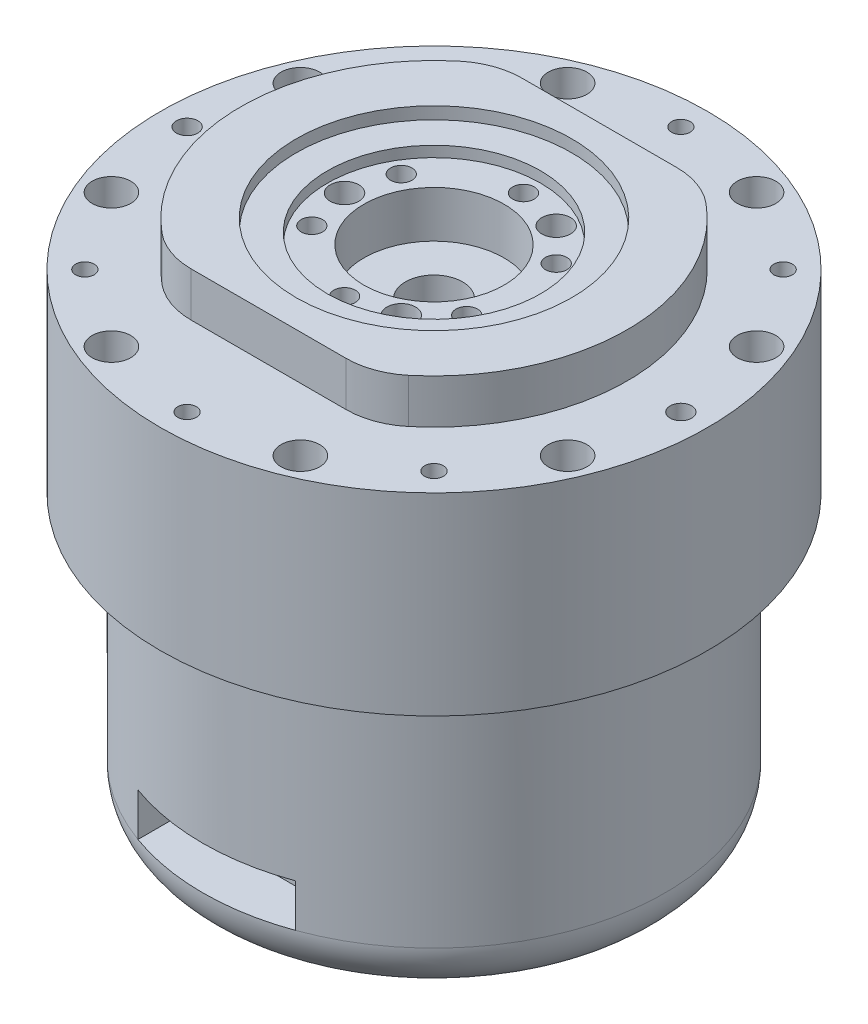
from build123d import *

# Parameters (mm, degrees)
SKETCH_2_R           = 38.25
SKETCH_2_R_2         = 1.3
EXTRUDE_1_DEPTH      = 27
EXTRUDE_2_DEPTH      = 6.2
SKETCH_4_R           = 19.25
CUT_EXTRUDE_1_DEPTH  = 1.7
SKETCH_5_R           = 14.9
CUT_EXTRUDE_2_DEPTH  = 3.2
SKETCH_6_R           = 1.5
CUT_EXTRUDE_3_DEPTH  = 8
SKETCH_7_R           = 2
CUT_EXTRUDE_4_DEPTH  = 4.5
SKETCH_8_R           = 32.3
EXTRUDE_3_DEPTH      = 39.3
FILLET_1_R           = 7
FILLET_2_R           = 10
SKETCH_9_W           = 22
SKETCH_9_H           = 6
CUT_EXTRUDE_5_DEPTH  = 15
SKETCH_10_W          = 22
SKETCH_10_H          = 13
CUT_EXTRUDE_6_DEPTH  = 15
SKETCH_12_R          = 9.8
CUT_EXTRUDE_7_DEPTH  = 6.5
SKETCH_13_R          = 4
CUT_EXTRUDE_8_DEPTH  = 6
SKETCH_14_R          = 2.7
CUT_EXTRUDE_9_DEPTH  = 7
SKETCH_15_R          = 1.2
CUT_EXTRUDE_10_DEPTH = 4
SKETCH_16_R          = 1.3
SKETCH_16_R_2        = 1.2
EXTRUDE_4_DEPTH      = 12
SKETCH_18_R          = 1.3
EXTRUDE_5_DEPTH      = 9
SKETCH_19_R          = 1.5
CUT_EXTRUDE_11_DEPTH = 10


with BuildPart() as part:
    # 草图2 → 凸台-拉伸1 (new body)
    with BuildSketch(Plane(origin=(0, 0, 0), x_dir=(1, 0, 0), z_dir=(0, 1, 0))):
        with Locations(Location((0, 0, 0), (0, 0, 270))):
            Circle(SKETCH_2_R)
        with Locations(Location((0, 34.5, 0), (0, 0, 270))):
            Circle(SKETCH_2_R_2, mode=Mode.SUBTRACT)
        with Locations(Location((-24.395183951, 24.395183951, 0), (0, 0, 270))):
            Circle(SKETCH_2_R_2, mode=Mode.SUBTRACT)
        with Locations(Location((-34.5, 0, 0), (0, 0, 270))):
            Circle(SKETCH_2_R_2, mode=Mode.SUBTRACT)
        with Locations(Location((-24.395183951, -24.395183951, 0), (0, 0, 270))):
            Circle(SKETCH_2_R_2, mode=Mode.SUBTRACT)
        with Locations(Location((0, -34.5, 0), (0, 0, 270))):
            Circle(SKETCH_2_R_2, mode=Mode.SUBTRACT)
        with Locations(Location((24.395183951, -24.395183951, 0), (0, 0, 270))):
            Circle(SKETCH_2_R_2, mode=Mode.SUBTRACT)
        with Locations(Location((34.5, 0, 0), (0, 0, 270))):
            Circle(SKETCH_2_R_2, mode=Mode.SUBTRACT)
        with Locations(Location((24.395183951, 24.395183951, 0), (0, 0, 270))):
            Circle(SKETCH_2_R_2, mode=Mode.SUBTRACT)
    extrude(amount=EXTRUDE_1_DEPTH)

    # 草图3 → 凸台-拉伸2 (add)
    with BuildSketch(Plane(origin=(0, 27, 0), x_dir=(1, 0, 0), z_dir=(0, 1, 0))):
        with BuildLine():
            Line((-13.978197309, 23.1), (13.978197309, 23.1))
            ThreePointArc((13.978197309, 23.1), (27, 0), (13.978197309, -23.1))
            Line((13.978197309, -23.1), (-13.978197309, -23.1))
            ThreePointArc((-13.978197309, -23.1), (-27, 0), (-13.978197309, 23.1))
        make_face()
    extrude(amount=EXTRUDE_2_DEPTH)

    # 草图4 → 切除-拉伸1 (cut)
    with BuildSketch(Plane(origin=(0, 33.2, 0), x_dir=(1, 0, 0), z_dir=(0, 1, 0))):
        with Locations(Location((0, 0, 0), (0, 0, 270))):
            Circle(SKETCH_4_R)
    extrude(amount=-CUT_EXTRUDE_1_DEPTH, mode=Mode.SUBTRACT)

    # 草图5 → 切除-拉伸2 (cut)
    with BuildSketch(Plane(origin=(0, 33.2, 0), x_dir=(1, 0, 0), z_dir=(0, 1, 0))):
        with Locations(Location((0, 0, 0), (0, 0, 270))):
            Circle(SKETCH_5_R)
    extrude(amount=-CUT_EXTRUDE_2_DEPTH, mode=Mode.SUBTRACT)

    # 草图6 → 切除-拉伸3 (cut)
    with BuildSketch(Plane(origin=(0, 30, 0), x_dir=(1, 0, 0), z_dir=(0, 1, 0))):
        with Locations(Location((0, -12.5, 0), (0, 0, 270))):
            Circle(SKETCH_6_R)
        with Locations(Location((10.825317547, -6.25, 0), (0, 0, 270))):
            Circle(SKETCH_6_R)
        with Locations(Location((10.825317547, 6.25, 0), (0, 0, 270))):
            Circle(SKETCH_6_R)
        with Locations(Location((-10.825317547, -6.25, 0), (0, 0, 270))):
            Circle(SKETCH_6_R)
        with Locations(Location((-10.825317547, 6.25, 0), (0, 0, 270))):
            Circle(SKETCH_6_R)
        with Locations(Location((0, 12.5, 0), (0, 0, 270))):
            Circle(SKETCH_6_R)
    extrude(amount=-CUT_EXTRUDE_3_DEPTH, mode=Mode.SUBTRACT)

    # 草图7 → 切除-拉伸4 (cut)
    with BuildSketch(Plane(origin=(0, 30, 0), x_dir=(1, 0, 0), z_dir=(0, 1, 0))):
        with Locations(Location((-12.5, 0, 0), (0, 0, 270))):
            Circle(SKETCH_7_R)
        with Locations(Location((6.25, -10.825317547, 0), (0, 0, 270))):
            Circle(SKETCH_7_R)
        with Locations(Location((6.25, 10.825317547, 0), (0, 0, 270))):
            Circle(SKETCH_7_R)
    extrude(amount=-CUT_EXTRUDE_4_DEPTH, mode=Mode.SUBTRACT)

    # 草图8 → 凸台-拉伸3 (add)
    with BuildSketch(Plane(origin=(0, 0, 0), x_dir=(1, 0, 0), z_dir=(0, 1, 0))):
        with Locations(Location((0, 0, 0), (0, 0, 270))):
            Circle(SKETCH_8_R)
    extrude(amount=-EXTRUDE_3_DEPTH)

    # 圆角1
    fillet_1_edges = [part.edges().sort_by_distance(p)[0] for p in [
        (0, -39.3, -32.3),
    ]]
    fillet(fillet_1_edges, radius=FILLET_1_R)

    # 圆角2
    fillet_2_edges = [part.edges().sort_by_distance(p)[0] for p in [
        (-13.978197309, 30.1, -23.1),
        (-13.978197309, 30.1, 23.1),
        (13.978197309, 30.1, 23.1),
        (13.978197309, 30.1, -23.1),
    ]]
    fillet(fillet_2_edges, radius=FILLET_2_R)

    # 草图9 → 切除-拉伸5 (cut)
    with BuildSketch(Plane.XY.offset(40)):
        with Locations((0, -29.3)):
            Rectangle(SKETCH_9_W, SKETCH_9_H)
    extrude(amount=-CUT_EXTRUDE_5_DEPTH, mode=Mode.SUBTRACT)

    # 草图10 → 切除-拉伸6 (cut)
    with BuildSketch(Plane.XY.offset(-40)):
        with Locations((0, -30.8)):
            Rectangle(SKETCH_10_W, SKETCH_10_H)
    extrude(amount=CUT_EXTRUDE_6_DEPTH, mode=Mode.SUBTRACT)

    # 草图12 → 切除-拉伸7 (cut)
    with BuildSketch(Plane(origin=(0, 30, 0), x_dir=(1, 0, 0), z_dir=(0, 1, 0))):
        with Locations(Location((0, 0, 0), (0, 0, 270))):
            Circle(SKETCH_12_R)
    extrude(amount=-CUT_EXTRUDE_7_DEPTH, mode=Mode.SUBTRACT)

    # 草图13 → 切除-拉伸8 (cut)
    with BuildSketch(Plane(origin=(0, 23.5, 0), x_dir=(1, 0, 0), z_dir=(0, 1, 0))):
        with Locations(Location((0, 0, 0), (0, 0, 270))):
            Circle(SKETCH_13_R)
    extrude(amount=-CUT_EXTRUDE_8_DEPTH, mode=Mode.SUBTRACT)

    # 草图14 → 切除-拉伸9 (cut)
    with BuildSketch(Plane(origin=(0, 27, 0), x_dir=(1, 0, 0), z_dir=(0, 1, 0))):
        with Locations(Location((31.873843872, 13.202578417, 0), (0, 0, 270))):
            Circle(SKETCH_14_R)
        with Locations(Location((31.873843872, -13.202578417, 0), (0, 0, 270))):
            Circle(SKETCH_14_R)
        with Locations(Location((13.202578417, -31.873843872, 0), (0, 0, 270))):
            Circle(SKETCH_14_R)
        with Locations(Location((-13.202578417, -31.873843872, 0), (0, 0, 270))):
            Circle(SKETCH_14_R)
        with Locations(Location((-31.873843872, -13.202578417, 0), (0, 0, 270))):
            Circle(SKETCH_14_R)
        with Locations(Location((-31.873843872, 13.202578417, 0), (0, 0, 270))):
            Circle(SKETCH_14_R)
        with Locations(Location((-13.202578417, 31.873843872, 0), (0, 0, 270))):
            Circle(SKETCH_14_R)
        with Locations(Location((13.202578417, 31.873843872, 0), (0, 0, 270))):
            Circle(SKETCH_14_R)
    extrude(amount=-CUT_EXTRUDE_9_DEPTH, mode=Mode.SUBTRACT)

    # 草图15 → 切除-拉伸10 (cut)
    with BuildSketch(Plane.XZ):
        with Locations(Location((13.202578417, 31.873843872, 0), (0, 0, 270))):
            Circle(SKETCH_15_R)
        with Locations(Location((-13.202578417, 31.873843872, 0), (0, 0, 270))):
            Circle(SKETCH_15_R)
        with Locations(Location((-31.873843872, 13.202578417, 0), (0, 0, 270))):
            Circle(SKETCH_15_R)
        with Locations(Location((-31.873843872, -13.202578417, 0), (0, 0, 270))):
            Circle(SKETCH_15_R)
        with Locations(Location((-13.202578417, -31.873843872, 0), (0, 0, 270))):
            Circle(SKETCH_15_R)
        with Locations(Location((13.202578417, -31.873843872, 0), (0, 0, 270))):
            Circle(SKETCH_15_R)
        with Locations(Location((31.873843872, -13.202578417, 0), (0, 0, 270))):
            Circle(SKETCH_15_R)
        with Locations(Location((31.873843872, 13.202578417, 0), (0, 0, 270))):
            Circle(SKETCH_15_R)
    extrude(amount=-CUT_EXTRUDE_10_DEPTH, mode=Mode.SUBTRACT)

    # 草图16 → 凸台-拉伸4 (add)
    # profile 1 of 6: a face of its own
    with BuildSketch(Plane.XZ):
        with Locations(Location((-24.395183951, -24.395183951, 0), (0, 0, 270))):
            Circle(SKETCH_16_R)
    # profile 2 of 6: a face of its own
    with BuildSketch(Plane.XZ):
        with Locations(Location((0, -34.5, 0), (0, 0, 270))):
            Circle(SKETCH_16_R)
        with Locations(Location((0, -34.5, 0), (0, 0, 270))):
            Circle(SKETCH_16_R_2, mode=Mode.SUBTRACT)
    # profile 3 of 6: a face of its own
    with BuildSketch(Plane.XZ):
        with Locations(Location((24.395183951, -24.395183951, 0), (0, 0, 270))):
            Circle(SKETCH_16_R)
    # profile 4 of 6: a face of its own
    with BuildSketch(Plane.XZ):
        with Locations(Location((24.395183951, 24.395183951, 0), (0, 0, 270))):
            Circle(SKETCH_16_R)
    # profile 5 of 6: a face of its own
    with BuildSketch(Plane.XZ):
        with Locations(Location((0, 34.5, 0), (0, 0, 270))):
            Circle(SKETCH_16_R)
        with Locations(Location((0, 34.5, 0), (0, 0, 270))):
            Circle(SKETCH_16_R_2, mode=Mode.SUBTRACT)
    # profile 6 of 6: a face of its own
    with BuildSketch(Plane.XZ):
        with Locations(Location((-24.395183951, 24.395183951, 0), (0, 0, 270))):
            Circle(SKETCH_16_R)
    extrude(amount=-EXTRUDE_4_DEPTH)

    # 草图18 → 凸台-拉伸5 (add)
    with BuildSketch(Plane(origin=(0, 8, 0), x_dir=(-1, 0, 0), z_dir=(0, -1, 0))):
        with Locations(Location((34.5, 0, 0), (0, 0, 90))):
            Circle(SKETCH_18_R)
        with Locations(Location((-34.5, 0, 0), (0, 0, 90))):
            Circle(SKETCH_18_R)
    extrude(amount=-EXTRUDE_5_DEPTH)

    # 草图19 → 切除-拉伸11 (cut)
    with BuildSketch(Plane(origin=(0, 27, 0), x_dir=(1, 0, 0), z_dir=(0, 1, 0))):
        with Locations(Location((-34.5, 0, 0), (0, 0, 270))):
            Circle(SKETCH_19_R)
        with Locations(Location((34.5, 0, 0), (0, 0, 270))):
            Circle(SKETCH_19_R)
    extrude(amount=-CUT_EXTRUDE_11_DEPTH, mode=Mode.SUBTRACT)


solid = part.part
